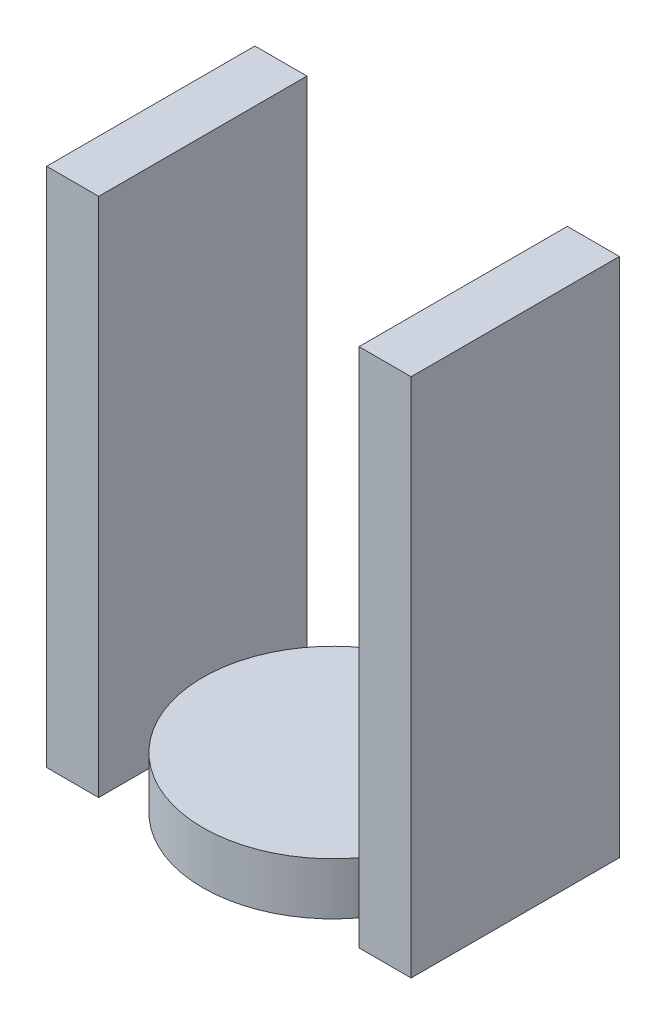
from build123d import *

# Parameters (mm, degrees)
SKETCH1_R             = 12.5
BOSS_EXTRUDE1_DEPTH   = 5
SKETCH2_W             = 5
SKETCH2_H             = 20
BOSS_EXTRUDE2_DEPTH   = 50
BOSS_EXTRUDE2_2_DEPTH = 50


with BuildPart() as part:
    # Sketch1 → Boss-Extrude1 (new body)
    with BuildSketch(Plane(origin=(0, 0, 0), x_dir=(1, 0, 0), z_dir=(0, 1, 0))):
        with Locations(Location((0, 0, 0), (0, 0, 270))):
            Circle(SKETCH1_R)
    extrude(amount=BOSS_EXTRUDE1_DEPTH)


with BuildPart() as body_2:
    # Sketch2 → Boss-Extrude2 (new body)
    with BuildSketch(Plane(origin=(0, 0, 0), x_dir=(1, 0, 0), z_dir=(0, 1, 0))):
        with Locations((-15, 0)):
            Rectangle(SKETCH2_W, SKETCH2_H)
    extrude(amount=BOSS_EXTRUDE2_DEPTH)


with BuildPart() as body_3:
    # Sketch2 → Boss-Extrude2 2 (new body)
    with BuildSketch(Plane(origin=(0, 0, 0), x_dir=(1, 0, 0), z_dir=(0, 1, 0))):
        with Locations((15, 0)):
            Rectangle(SKETCH2_W, SKETCH2_H)
    extrude(amount=BOSS_EXTRUDE2_2_DEPTH)


solid = Compound([part.part, body_2.part, body_3.part])
